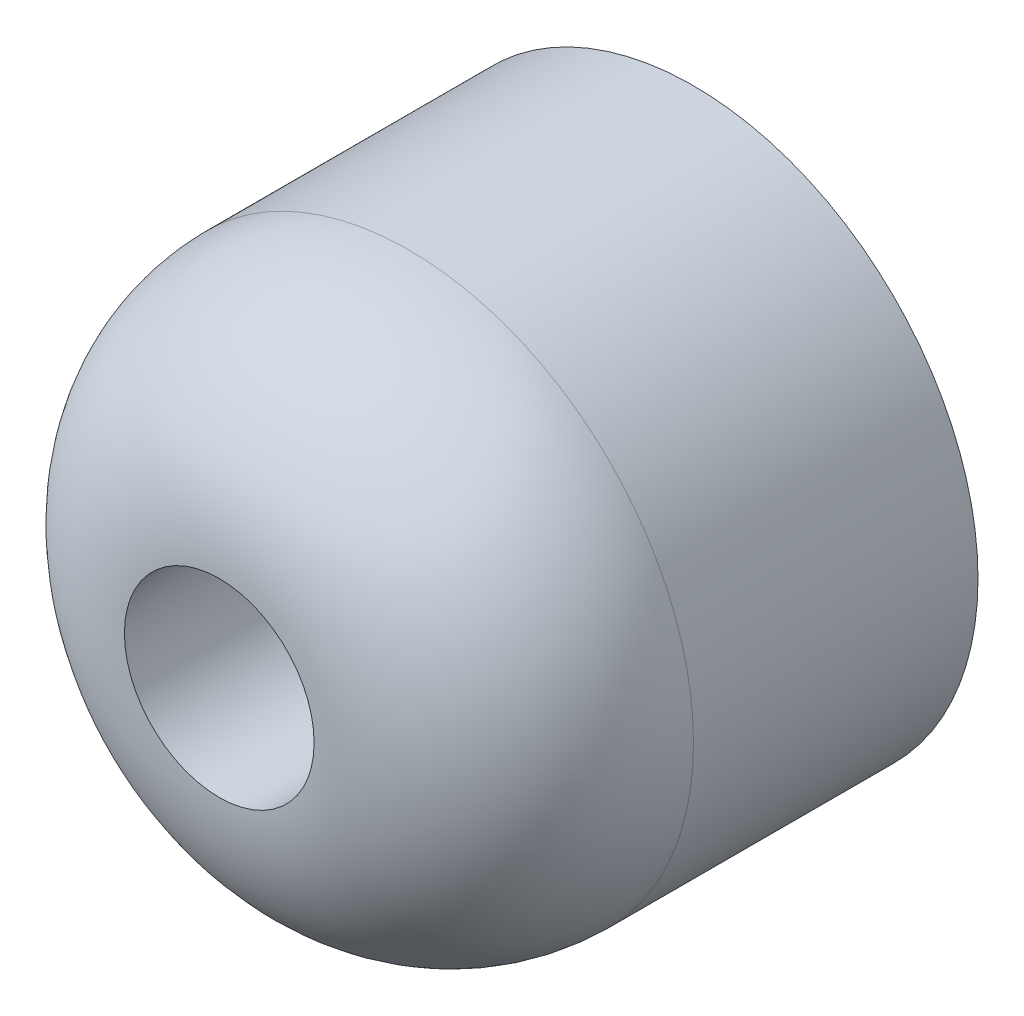
from build123d import *

# Parameters (mm, degrees)
SKETCH1_R           = 3
BOSS_EXTRUDE1_DEPTH = 5
FILLET3_R           = 2
SKETCH2_R           = 1
CUT_EXTRUDE1_DEPTH  = 10


with BuildPart() as part:
    # Sketch1 → Boss-Extrude1 (new body)
    with BuildSketch(Plane.XY):
        Circle(SKETCH1_R)
    extrude(amount=BOSS_EXTRUDE1_DEPTH)

    # Fillet3
    fillet3_edges = [part.edges().sort_by_distance(p)[0] for p in [
        (-3, 0, 5),
    ]]
    fillet(fillet3_edges, radius=FILLET3_R)

    # Sketch2 → Cut-Extrude1 (cut)
    with BuildSketch(Plane(origin=(0, 0, 0), x_dir=(-1, 0, 0), z_dir=(0, 0, -1))):
        Circle(SKETCH2_R)
    extrude(amount=-CUT_EXTRUDE1_DEPTH, mode=Mode.SUBTRACT)


solid = part.part
